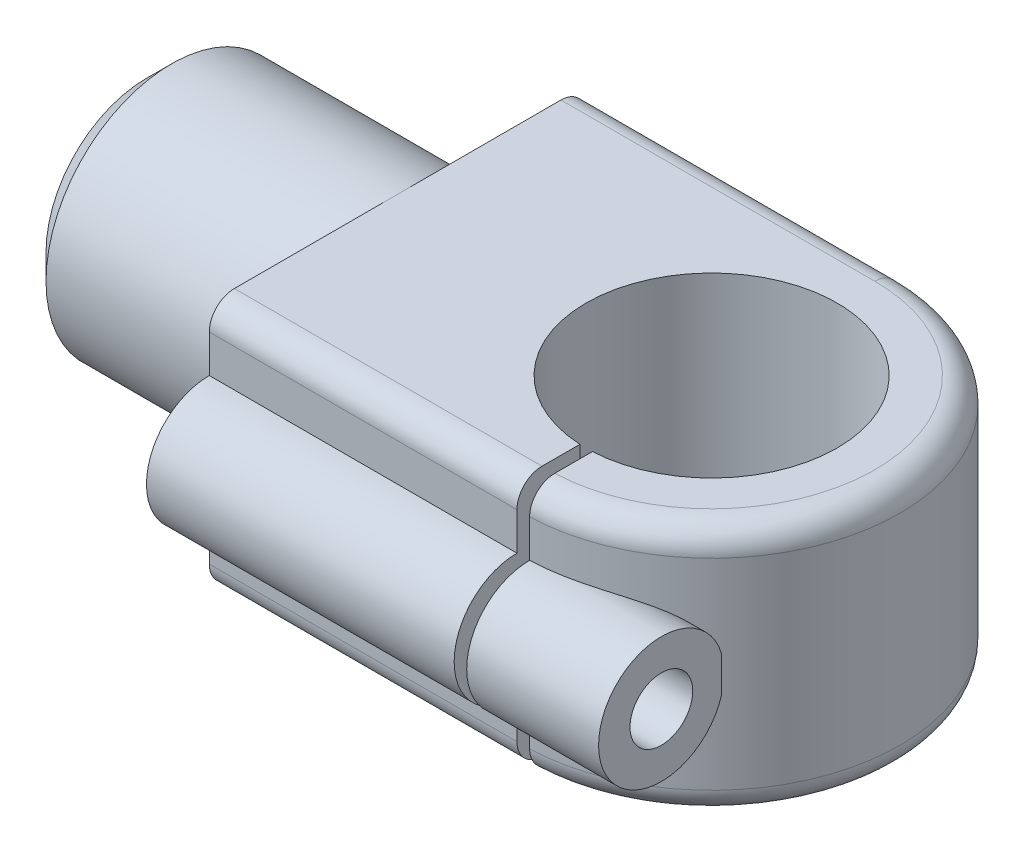
from build123d import *
from build123d.topology import SkipClean

# Parameters (mm, degrees)
BOSS_EXTRUDE1_DEPTH = 20
SKETCH2_R           = 5
BOSS_EXTRUDE2_DEPTH = 41
CUT_EXTRUDE1_DEPTH  = 41
SKETCH4_R           = 2.5
CUT_EXTRUDE2_DEPTH  = 50.809637702
FILLET1_R           = 2
SKETCH5_R           = 10
BOSS_EXTRUDE3_DEPTH = 15
CUT_EXTRUDE3_DEPTH  = 5
CHAMFER1_SIZE       = 2


with BuildPart() as part:
    # Sketch1 → Boss-Extrude1 (new body)
    with BuildSketch(Plane(origin=(0, 0, 0), x_dir=(1, 0, 0), z_dir=(0, 1, 0))):
        with BuildLine():
            ThreePointArc((0.5, -14.991664351), (14.997915943, 0.250034739), (0, 15))
            Line((0, 15), (-30, 15))
            Line((-30, 15), (-30, -15))
            Line((-30, -15), (-0.5, -15))
            Line((-0.5, -15), (-0.5, -9.987492178))
            ThreePointArc((-0.5, -9.987492178), (0, 10), (0.5, -9.987492178))
            Line((0.5, -9.987492178), (0.5, -14.991664351))
        make_face()
    extrude(amount=BOSS_EXTRUDE1_DEPTH)

    # Sketch2 → Boss-Extrude2 (add)
    with BuildSketch(Plane.ZY.offset(30)):
        with Locations(Location((15, 10, 0), (0, 0, 270))):
            Circle(SKETCH2_R)
    extrude(amount=-BOSS_EXTRUDE2_DEPTH)

    # Sketch3 → Cut-Extrude1 (cut)
    with BuildSketch(Plane(origin=(0, 20, 0), x_dir=(1, 0, 0), z_dir=(0, 1, 0))):
        Polygon((-0.5, -15), (-0.5, -9.987492178), (0.5, -9.987492178), (0.5, -14.991664351), (0.5, -20), (-0.5, -20), align=None)
    extrude(amount=-CUT_EXTRUDE1_DEPTH, mode=Mode.SUBTRACT)

    # Sketch4 → Cut-Extrude2 (cut, through all)
    with BuildSketch(Plane(origin=(11, 0, 0), x_dir=(0, 0, -1), z_dir=(1, 0, 0))):
        with Locations((-15, 10)):
            Circle(SKETCH4_R)
    extrude(amount=-CUT_EXTRUDE2_DEPTH, mode=Mode.SUBTRACT)

    # Fillet1
    fillet1_edges = [part.edges().sort_by_distance(p)[0] for p in [
        (-15, 0, -15),
        (14.997915943, 0, -0.250034739),
        (-15, 20, -15),
        (-15.25, 20, 15),
        (14.997915943, 20, -0.250034739),
        (-15.25, 0, 15),
    ]]
    fillet(fillet1_edges, radius=FILLET1_R)

    # Sketch5 → Boss-Extrude3 (add)
    with BuildSketch(Plane.ZY.offset(30)):
        with Locations(Location((0, 10, 0), (0, 0, 270))):
            Circle(SKETCH5_R)
    extrude(amount=BOSS_EXTRUDE3_DEPTH)

    # Sketch6 → Cut-Extrude3 (cut)
    with SkipClean():  # the faces are left unmerged after this step: merging them gives an invalid solid
        with BuildSketch(Plane.ZY.offset(30)):
            with BuildLine():
                ThreePointArc((0, 0), (-10, 10), (0, 20))
                Line((0, 20), (-13, 20))
                ThreePointArc((-13, 20), (-14.414213562, 19.414213562), (-15, 18))
                Line((-15, 18), (-15, 2))
                ThreePointArc((-15, 2), (-14.414213562, 0.585786438), (-13, 0))
                Line((-13, 0), (0, 0))
            make_face()
            with BuildLine():
                Line((13, 20), (0, 20))
                ThreePointArc((0, 20), (10, 10), (0, 0))
                Line((0, 0), (13, 0))
                ThreePointArc((13, 0), (14.414213562, 0.585786438), (15, 2))
                Line((15, 2), (15, 5))
                ThreePointArc((15, 5), (20, 10), (15, 15))
                Line((15, 15), (15, 18))
                ThreePointArc((15, 18), (14.414213562, 19.414213562), (13, 20))
            make_face()
        extrude(amount=-CUT_EXTRUDE3_DEPTH, mode=Mode.SUBTRACT)

    # Chamfer1
    chamfer1_edges = [part.edges().sort_by_distance(p)[0] for p in [
        (-45, 20, 0),
    ]]
    chamfer(chamfer1_edges, length=CHAMFER1_SIZE)


solid = part.part
